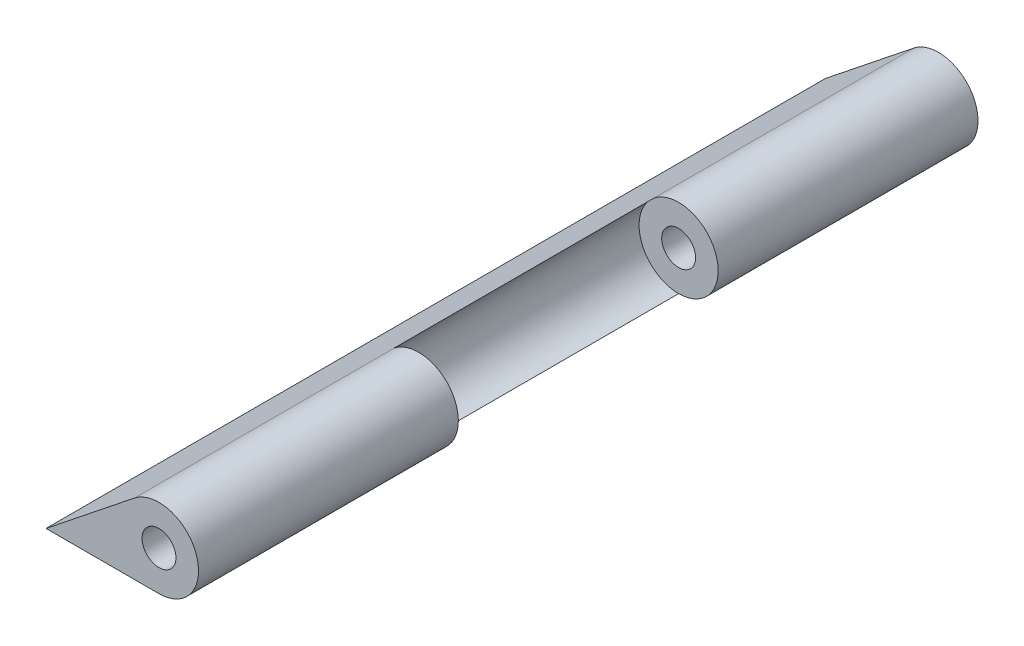
from build123d import *

# Parameters (mm, degrees)
SKETCH1_R           = 3.5
SKETCH1_R_2         = 1.5
BOSS_EXTRUDE1_DEPTH = 34.5
BOSS_EXTRUDE2_DEPTH = 34.5
SKETCH5_R           = 3.5
CUT_EXTRUDE1_DEPTH  = 11.5


with BuildPart() as part:
    # Sketch1 → Boss-Extrude1 (new, symmetric)
    with BuildSketch(Plane.XY):
        Circle(SKETCH1_R)
        Circle(SKETCH1_R_2, mode=Mode.SUBTRACT)
    extrude(amount=BOSS_EXTRUDE1_DEPTH, both=True)

    # Sketch2 → Boss-Extrude2 (add, symmetric)
    with BuildSketch(Plane.XY):
        with BuildLine():
            Line((0, -3.5), (-10, -3.5))
            Line((-10, -3.5), (-2.182628062, 2.736080178))
            ThreePointArc((-2.182628062, 2.736080178), (-3.303504247, -1.156226487), (0, -3.5))
        make_face()
    extrude(amount=BOSS_EXTRUDE2_DEPTH, both=True)

    # Sketch5 → Cut-Extrude1 (cut, symmetric)
    with BuildSketch(Plane.XY):
        Circle(SKETCH5_R)
    extrude(amount=CUT_EXTRUDE1_DEPTH, both=True, mode=Mode.SUBTRACT)


solid = part.part
